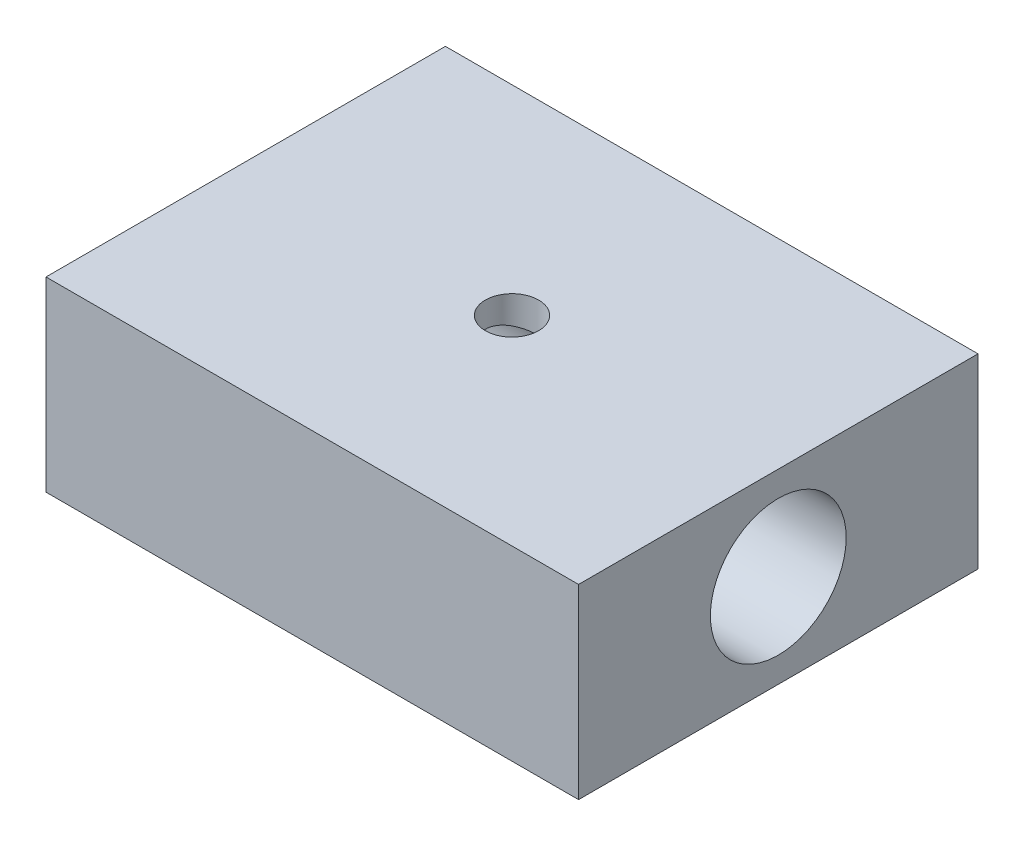
from build123d import *

# Parameters (mm, degrees)
SKETCH_2_W          = 30
SKETCH_2_H          = 14
SKETCH_2_R          = 5.1
EXTRUDE_1_DEPTH     = 40
SKETCH_3_R          = 2
CUT_EXTRUDE_1_DEPTH = 52.923019943


with BuildPart() as part:
    # 草圖2 → 填料-伸長1 (new body)
    with BuildSketch(Plane(origin=(0, 0, 0), x_dir=(0, 0, -1), z_dir=(1, 0, 0))):
        with Locations((15, 7)):
            Rectangle(SKETCH_2_W, SKETCH_2_H)
        with Locations((15, 7)):
            Circle(SKETCH_2_R, mode=Mode.SUBTRACT)
    extrude(amount=EXTRUDE_1_DEPTH)

    # 草圖3 → 除料-伸長1 (cut, through all)
    with BuildSketch(Plane(origin=(0, 14, 0), x_dir=(1, 0, 0), z_dir=(0, 1, 0))):
        with Locations(Location((20, 15, 0), (0, 0, 270))):
            Circle(SKETCH_3_R)
    extrude(amount=-CUT_EXTRUDE_1_DEPTH, mode=Mode.SUBTRACT)


solid = part.part
